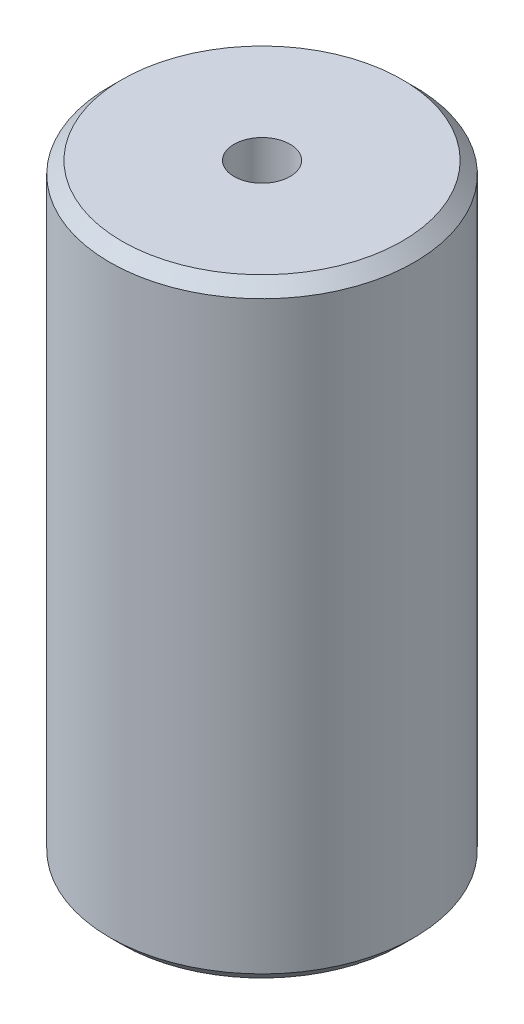
from build123d import *

# Parameters (mm, degrees)
SKETCH2_R           = 6.25
BOSS_EXTRUDE1_DEPTH = 9
SKETCH3_R           = 6.25
BOSS_EXTRUDE2_DEPTH = 7
SKETCH4_R           = 6.25
BOSS_EXTRUDE3_DEPTH = 9
SKETCH5_R           = 2
CUT_EXTRUDE1_DEPTH  = 12.5
SKETCH6_R           = 1.15
CUT_EXTRUDE2_DEPTH  = 12.5
CHAMFER2_SIZE       = 0.5


with BuildPart() as part:
    # Sketch2 → Boss-Extrude1 (new body)
    with BuildSketch(Plane(origin=(0, 0, 0), x_dir=(1, 0, 0), z_dir=(0, 1, 0))):
        with Locations(Location((0, 0, 0), (0, 0, 270))):
            Circle(SKETCH2_R)
    extrude(amount=BOSS_EXTRUDE1_DEPTH)

    # Sketch3 → Boss-Extrude2 (add)
    with BuildSketch(Plane(origin=(0, 9, 0), x_dir=(1, 0, 0), z_dir=(0, 1, 0))):
        with Locations(Location((0, 0, 0), (0, 0, 270))):
            Circle(SKETCH3_R)
    extrude(amount=BOSS_EXTRUDE2_DEPTH)

    # Sketch4 → Boss-Extrude3 (add)
    with BuildSketch(Plane(origin=(0, 16, 0), x_dir=(1, 0, 0), z_dir=(0, 1, 0))):
        with Locations(Location((0, 0, 0), (0, 0, 270))):
            Circle(SKETCH4_R)
    extrude(amount=BOSS_EXTRUDE3_DEPTH)

    # Sketch5 → Cut-Extrude1 (cut)
    with BuildSketch(Plane.XZ):
        with Locations(Location((0, 0, 0), (0, 0, 270))):
            Circle(SKETCH5_R)
    extrude(amount=-CUT_EXTRUDE1_DEPTH, mode=Mode.SUBTRACT)

    # Sketch6 → Cut-Extrude2 (cut)
    with BuildSketch(Plane(origin=(0, 25, 0), x_dir=(1, 0, 0), z_dir=(0, 1, 0))):
        with Locations(Location((0, 0, 0), (0, 0, 270))):
            Circle(SKETCH6_R)
    extrude(amount=-CUT_EXTRUDE2_DEPTH, mode=Mode.SUBTRACT)

    # Chamfer2
    chamfer2_edges = [part.edges().sort_by_distance(p)[0] for p in [
        (0, 25, -6.25),
        (0, 0, -6.25),
    ]]
    chamfer(chamfer2_edges, length=CHAMFER2_SIZE)


solid = part.part
